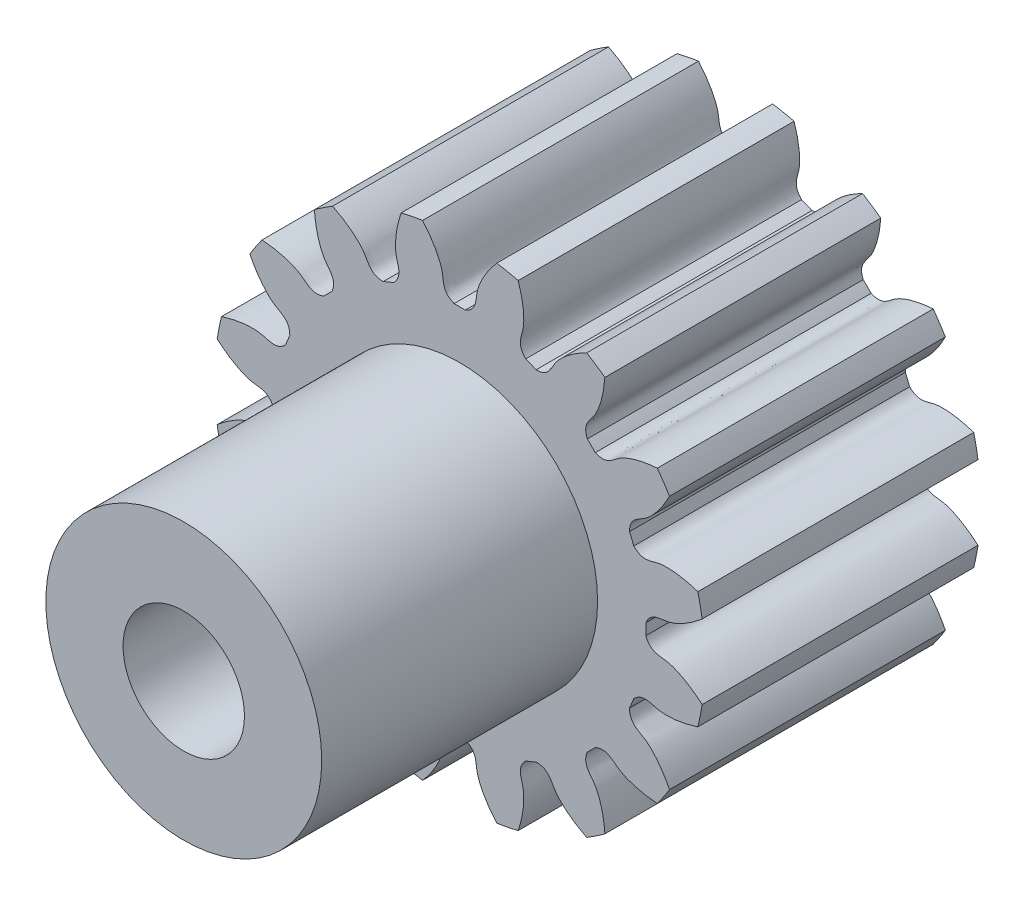
from build123d import *

# Parameters (mm, degrees)
SKETCH_1_R               = 4.4455
EXTRUDE_1_DEPTH          = 5
CUT_EXTRUDE_1_DEPTH      = 9.03274178
PATTERN_CIRCULAR_1_COUNT = 16
SKETCH_4_R               = 2.5
EXTRUDE_2_DEPTH          = 5
SKETCH_5_R               = 1.1
CUT_EXTRUDE_2_DEPTH      = 5


with BuildPart() as part:
    # 草图1 → 凸台-拉伸1 (new body)
    with BuildSketch(Plane.XY):
        Circle(SKETCH_1_R)
    extrude(amount=EXTRUDE_1_DEPTH)

    # 草图2 → 切除-拉伸1 (cut, through all)
    with BuildSketch(Plane.XY):
        with BuildLine():
            ThreePointArc((0.101680395, 3.373467963), (0, 3.375), (-0.101680395, 3.373467963))
            add(Edge.make_bspline(
                [(-0.101680395, 3.373467963), (-0.320919735, 3.465061005), (-0.284660598, 3.635349809), (-0.322390644, 3.793404963), (-0.325601394, 3.80577545), (-0.329466049, 3.819526781), (-0.334039479, 3.834637453), (-0.339377888, 3.851083952), (-0.345536205, 3.868841182), (-0.352568839, 3.887882349), (-0.360529384, 3.908179024), (-0.369470654, 3.92970115), (-0.379444617, 3.952417062), (-0.390502356, 3.976293514), (-0.402694025, 4.001295699), (-0.416068812, 4.02738727), (-0.430674889, 4.054530373), (-0.446559381, 4.082685666), (-0.463768319, 4.111812348), (-0.482346604, 4.141868189), (-0.502337967, 4.172809557), (-0.523784931, 4.20459145), (-0.546728776, 4.237167525), (-0.571209498, 4.270490132), (-0.597265778, 4.304510345), (-0.624934946, 4.339177997), (-0.654252942, 4.374441713), (-0.685254293, 4.41024895), (-0.717972069, 4.446546028), (-0.752437861, 4.483278171), (-0.788681746, 4.520389541), (-0.826732258, 4.557823283), (-0.866616358, 4.595521557), (-0.90835941, 4.633425586), (-0.951985152, 4.67147569), (-0.99751567, 4.709611333), (-1.044971373, 4.747771162), (-1.094370973, 4.785893051), (-1.145731457, 4.823914147), (-1.199068068, 4.861770909), (-1.254394291, 4.899399156), (-1.311721812, 4.936734115), (-1.391690876, 4.986566032), (-1.453432198, 5.022488672), (-1.495483309, 5.045865424)],
                knots=[0, 0, 0, 0, 0.207660269, 0.212713456, 0.218440401, 0.224841105, 0.231915567, 0.239663787, 0.248085766, 0.257181502, 0.266950997, 0.277394251, 0.288511262, 0.300302032, 0.31276656, 0.325904847, 0.339716891, 0.354202694, 0.369362255, 0.385195575, 0.401702653, 0.418883489, 0.436738083, 0.455266435, 0.474468546, 0.494344415, 0.514894043, 0.536117428, 0.558014572, 0.580585474, 0.603830135, 0.627748554, 0.652340731, 0.677606666, 0.703546359, 0.730159811, 0.757447021, 0.78540799, 0.814042716, 0.843351201, 0.873333445, 0.903989446, 0.935319206, 1, 1, 1, 1], degree=3))
            ThreePointArc((-1.495483309, 5.045865424), (0, 5.262815616), (1.495483309, 5.045865424))
            add(Edge.make_bspline(
                [(0.101680395, 3.373467963), (0.320919735, 3.465061005), (0.284660598, 3.635349809), (0.322390644, 3.793404963), (0.325601394, 3.80577545), (0.329466049, 3.819526781), (0.334039479, 3.834637453), (0.339377888, 3.851083952), (0.345536205, 3.868841182), (0.352568839, 3.887882349), (0.360529384, 3.908179024), (0.369470654, 3.92970115), (0.379444617, 3.952417062), (0.390502356, 3.976293514), (0.402694025, 4.001295699), (0.416068812, 4.02738727), (0.430674889, 4.054530373), (0.446559381, 4.082685666), (0.463768319, 4.111812348), (0.482346604, 4.141868189), (0.502337967, 4.172809557), (0.523784931, 4.20459145), (0.546728776, 4.237167525), (0.571209498, 4.270490132), (0.597265778, 4.304510345), (0.624934946, 4.339177997), (0.654252942, 4.374441713), (0.685254293, 4.41024895), (0.717972069, 4.446546028), (0.752437861, 4.483278171), (0.788681746, 4.520389541), (0.826732258, 4.557823283), (0.866616358, 4.595521557), (0.90835941, 4.633425586), (0.951985152, 4.67147569), (0.99751567, 4.709611333), (1.044971373, 4.747771162), (1.094370973, 4.785893051), (1.145731457, 4.823914147), (1.199068068, 4.861770909), (1.254394291, 4.899399156), (1.311721812, 4.936734115), (1.391690876, 4.986566032), (1.453432198, 5.022488672), (1.495483309, 5.045865424)],
                knots=[0, 0, 0, 0, 0.207660269, 0.212713456, 0.218440401, 0.224841105, 0.231915567, 0.239663787, 0.248085766, 0.257181502, 0.266950997, 0.277394251, 0.288511262, 0.300302032, 0.31276656, 0.325904847, 0.339716891, 0.354202694, 0.369362255, 0.385195575, 0.401702653, 0.418883489, 0.436738083, 0.455266435, 0.474468546, 0.494344415, 0.514894043, 0.536117428, 0.558014572, 0.580585474, 0.603830135, 0.627748554, 0.652340731, 0.677606666, 0.703546359, 0.730159811, 0.757447021, 0.78540799, 0.814042716, 0.843351201, 0.873333445, 0.903989446, 0.935319206, 1, 1, 1, 1], degree=3))
        make_face()
    cut_extrude_1 = extrude(amount=CUT_EXTRUDE_1_DEPTH, mode=Mode.SUBTRACT)

    # 阵列(圆周)1: 切除-拉伸1 ×16 about axis
    pattern_circular_1_axis = Axis((0, 0, 5), (0, 0, -1))
    for i in range(1, PATTERN_CIRCULAR_1_COUNT):
        add(cut_extrude_1.rotate(pattern_circular_1_axis, i * 360 / PATTERN_CIRCULAR_1_COUNT), mode=Mode.SUBTRACT)

    # 草图4 → 凸台-拉伸2 (add)
    with BuildSketch(Plane.XY.offset(5)):
        Circle(SKETCH_4_R)
    extrude(amount=EXTRUDE_2_DEPTH)

    # 草图5 → 切除-拉伸2 (cut)
    with BuildSketch(Plane.XY.offset(10)):
        Circle(SKETCH_5_R)
    extrude(amount=-CUT_EXTRUDE_2_DEPTH, mode=Mode.SUBTRACT)


solid = part.part
